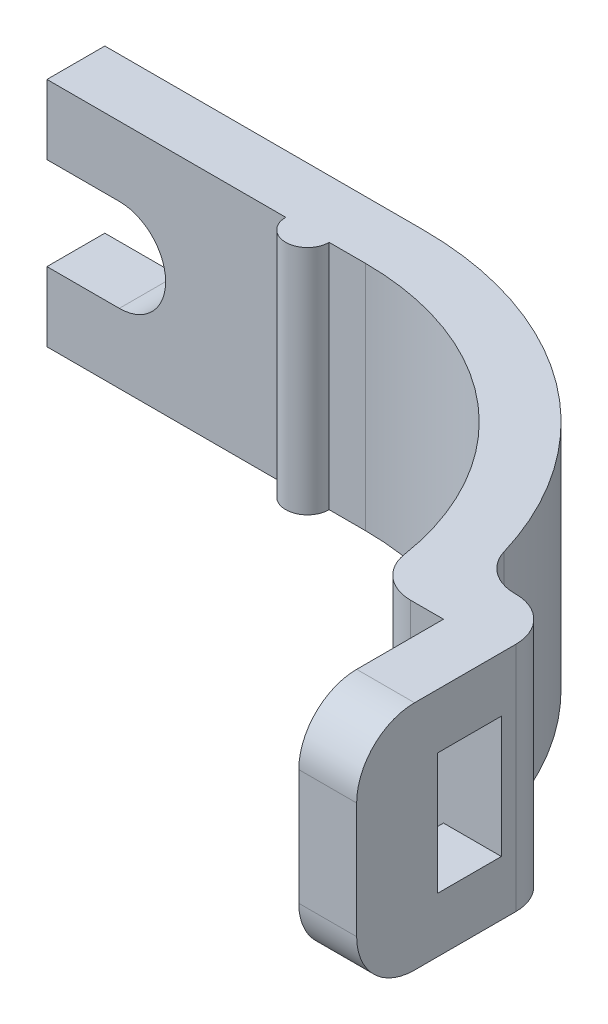
from build123d import *

# Parameters (mm, degrees)
EXTRUDE_1_DEPTH     = 8
CUT_EXTRUDE_1_REACH = 28.93
SKETCH_3_W          = 2.2
SKETCH_3_H          = 4.2
CUT_EXTRUDE_2_REACH = 24.928
FILLET_1_R          = 1.5
FILLET_2_R          = 2
SKETCH_5_R          = 0.75
EXTRUDE_1_2_DEPTH   = 8


with BuildPart() as part:
    # 草图1 → Extrude 1 (new body)
    with BuildSketch(Plane(origin=(0, 0, 0), x_dir=(1, 0, 0), z_dir=(0, 1, 0))):
        with BuildLine():
            Line((-11, 9.5), (0, 9.5))
            ThreePointArc((0, 9.5), (6.646427612, 6.787856805), (9.497894504, 0.2))
            Line((9.497894504, 0.2), (12, 0.2))
            Line((12, 0.2), (12, -4.8))
            Line((12, -4.8), (14, -4.8))
            Line((14, -4.8), (14, 2.2))
            Line((14, 2.2), (11.28760382, 2.2))
            ThreePointArc((11.28760382, 2.2), (7.312660255, 8.875528153), (0, 11.5))
            Line((0, 11.5), (-11, 11.5))
            Line((-11, 11.5), (-11, 9.5))
        make_face()
    extrude(amount=EXTRUDE_1_DEPTH)

    # 草图3 → 切除-拉伸1 (cut, up to next)
    with BuildSketch(Plane.ZY.offset(-12), mode=Mode.PRIVATE) as cut_extrude_1_sk1:
        with Locations((0.9, 4)):
            Rectangle(SKETCH_3_W, SKETCH_3_H)
    cut_extrude_1_tool1 = extrude(cut_extrude_1_sk1.sketch, amount=-CUT_EXTRUDE_1_REACH, mode=Mode.PRIVATE) & part.part
    add(cut_extrude_1_tool1.solids().sort_by_distance((12, 4, 0.9))[0], mode=Mode.SUBTRACT)

    # 草图4 → 切除-拉伸2 (cut, up to next)
    with BuildSketch(Plane(origin=(0, 0, -11.5), x_dir=(-1, 0, 0), z_dir=(0, 0, -1)), mode=Mode.PRIVATE) as cut_extrude_2_sk1:
        with BuildLine():
            Line((11, 2.4), (8.5, 2.4))
            ThreePointArc((8.5, 2.4), (6.9, 4), (8.5, 5.6))
            Line((8.5, 5.6), (11, 5.6))
            ThreePointArc((11, 5.6), (12.6, 4), (11, 2.4))
        make_face()
    cut_extrude_2_tool1 = extrude(cut_extrude_2_sk1.sketch, amount=-CUT_EXTRUDE_2_REACH, mode=Mode.PRIVATE) & part.part
    add(cut_extrude_2_tool1.solids().sort_by_distance((-9.75, 4, -11.5))[0], mode=Mode.SUBTRACT)

    # 圆角1
    fillet_1_edges = [part.edges().sort_by_distance(p)[0] for p in [
        (11.28760382, 4, -2.2),
        (14, 4, -2.2),
        (9.497894504, 4, -0.2),
    ]]
    fillet(fillet_1_edges, radius=FILLET_1_R)

    # 圆角2
    fillet_2_edges = [part.edges().sort_by_distance(p)[0] for p in [
        (13, 8, 4.8),
        (13, 0, 4.8),
    ]]
    fillet(fillet_2_edges, radius=FILLET_2_R)

    # 草图5 → Extrude 1 2 (add)
    with BuildSketch(Plane(origin=(0, 8, 0), x_dir=(1, 0, 0), z_dir=(0, 1, 0))):
        with Locations((-2, 9.5)):
            Circle(SKETCH_5_R)
    extrude(amount=-EXTRUDE_1_2_DEPTH)


solid = part.part
